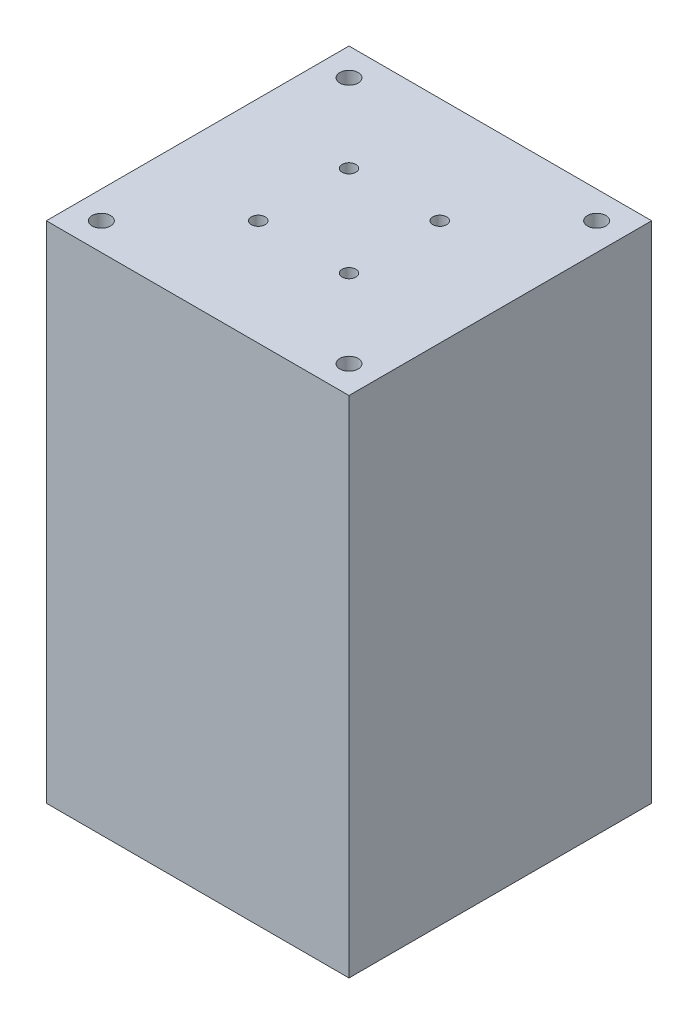
from build123d import *

# Parameters (mm, degrees)
SKETCH_1_W          = 66
SKETCH_1_H          = 66
SKETCH_1_W_2        = 42
SKETCH_1_H_2        = 42
EXTRUDE_1_DEPTH     = 110
SKETCH_2_W          = 42
SKETCH_2_H          = 42
CUT_EXTRUDE_1_DEPTH = 76
SKETCH_3_R          = 18
CUT_EXTRUDE_2_DEPTH = 28
SKETCH_4_R          = 11
CUT_EXTRUDE_3_DEPTH = 2
SKETCH_5_R          = 1.5
SKETCH_5_R_2        = 2
CUT_EXTRUDE_4_DEPTH = 120.490585403
CHAMFER_1_SIZE      = 6
CUT_EXTRUDE_5_REACH = 134.458
SKETCH_6_W          = 16
SKETCH_6_H          = 25
CUT_EXTRUDE_6_REACH = 134.458
SKETCH_7_W          = 25
SKETCH_7_H          = 10


with BuildPart() as part:
    # 草图1 → 凸台-拉伸1 (new body)
    # profile 1 of 2: a face of its own
    with BuildSketch(Plane(origin=(0, 0, 0), x_dir=(1, 0, 0), z_dir=(0, 1, 0))):
        Rectangle(SKETCH_1_W, SKETCH_1_H)
        Rectangle(SKETCH_1_W_2, SKETCH_1_H_2, mode=Mode.SUBTRACT)
    # profile 2 of 2: a face of its own
    with BuildSketch(Plane(origin=(0, 0, 0), x_dir=(1, 0, 0), z_dir=(0, 1, 0))):
        Rectangle(SKETCH_1_W_2, SKETCH_1_H_2)
    extrude(amount=EXTRUDE_1_DEPTH)

    # 草图2 → 切除-拉伸1 (cut)
    with BuildSketch(Plane.XZ):
        Rectangle(SKETCH_2_W, SKETCH_2_H)
    extrude(amount=-CUT_EXTRUDE_1_DEPTH, mode=Mode.SUBTRACT)

    # 草图3 → 切除-拉伸2 (cut)
    with BuildSketch(Plane.XZ.offset(-76)):
        with Locations(Location((0, 0, 0), (0, 0, 270))):
            Circle(SKETCH_3_R)
    extrude(amount=-CUT_EXTRUDE_2_DEPTH, mode=Mode.SUBTRACT)

    # 草图4 → 切除-拉伸3 (cut)
    with BuildSketch(Plane.XZ.offset(-104)):
        with Locations(Location((0, 0, 0), (0, 0, 270))):
            Circle(SKETCH_4_R)
    extrude(amount=-CUT_EXTRUDE_3_DEPTH, mode=Mode.SUBTRACT)

    # 草图5 → 切除-拉伸4 (cut, through all)
    with BuildSketch(Plane(origin=(0, 110, 0), x_dir=(1, 0, 0), z_dir=(0, 1, 0))):
        with Locations(Location((-9.899494937, 9.899494937, 0), (0, 0, 270))):
            Circle(SKETCH_5_R)
        with Locations(Location((9.899494937, 9.899494937, 0), (0, 0, 270))):
            Circle(SKETCH_5_R)
        with Locations(Location((9.899494937, -9.899494937, 0), (0, 0, 270))):
            Circle(SKETCH_5_R)
        with Locations(Location((-9.899494937, -9.899494937, 0), (0, 0, 270))):
            Circle(SKETCH_5_R)
        with Locations(Location((-27, 27, 0), (0, 0, 270))):
            Circle(SKETCH_5_R_2)
        with Locations(Location((27, 27, 0), (0, 0, 270))):
            Circle(SKETCH_5_R_2)
        with Locations(Location((-27, -27, 0), (0, 0, 270))):
            Circle(SKETCH_5_R_2)
        with Locations(Location((27, -27, 0), (0, 0, 270))):
            Circle(SKETCH_5_R_2)
    extrude(amount=-CUT_EXTRUDE_4_DEPTH, mode=Mode.SUBTRACT)

    # 倒角1
    chamfer_1_edges = [part.edges().sort_by_distance(p)[0] for p in [
        (21, 38, -21),
        (-21, 38, -21),
        (-21, 38, 21),
        (21, 38, 21),
    ]]
    chamfer(chamfer_1_edges, length=CHAMFER_1_SIZE)

    # 草图6 → 切除-拉伸5 (cut, up to next)
    with BuildSketch(Plane(origin=(0, 0, -33), x_dir=(-1, 0, 0), z_dir=(0, 0, -1)), mode=Mode.PRIVATE) as cut_extrude_5_sk1:
        with Locations((0, 12.5)):
            Rectangle(SKETCH_6_W, SKETCH_6_H)
    cut_extrude_5_tool1 = extrude(cut_extrude_5_sk1.sketch, amount=-CUT_EXTRUDE_5_REACH, mode=Mode.PRIVATE) & part.part
    add(cut_extrude_5_tool1.solids().sort_by_distance((0, 12.5, -33))[0], mode=Mode.SUBTRACT)

    # 草图7 → 切除-拉伸6 (cut, up to next)
    with BuildSketch(Plane.ZY.offset(33), mode=Mode.PRIVATE) as cut_extrude_6_sk1:
        with Locations((0, 5)):
            Rectangle(SKETCH_7_W, SKETCH_7_H)
    cut_extrude_6_tool1 = extrude(cut_extrude_6_sk1.sketch, amount=-CUT_EXTRUDE_6_REACH, mode=Mode.PRIVATE) & part.part
    add(cut_extrude_6_tool1.solids().sort_by_distance((-33, 5, 0))[0], mode=Mode.SUBTRACT)


solid = part.part
